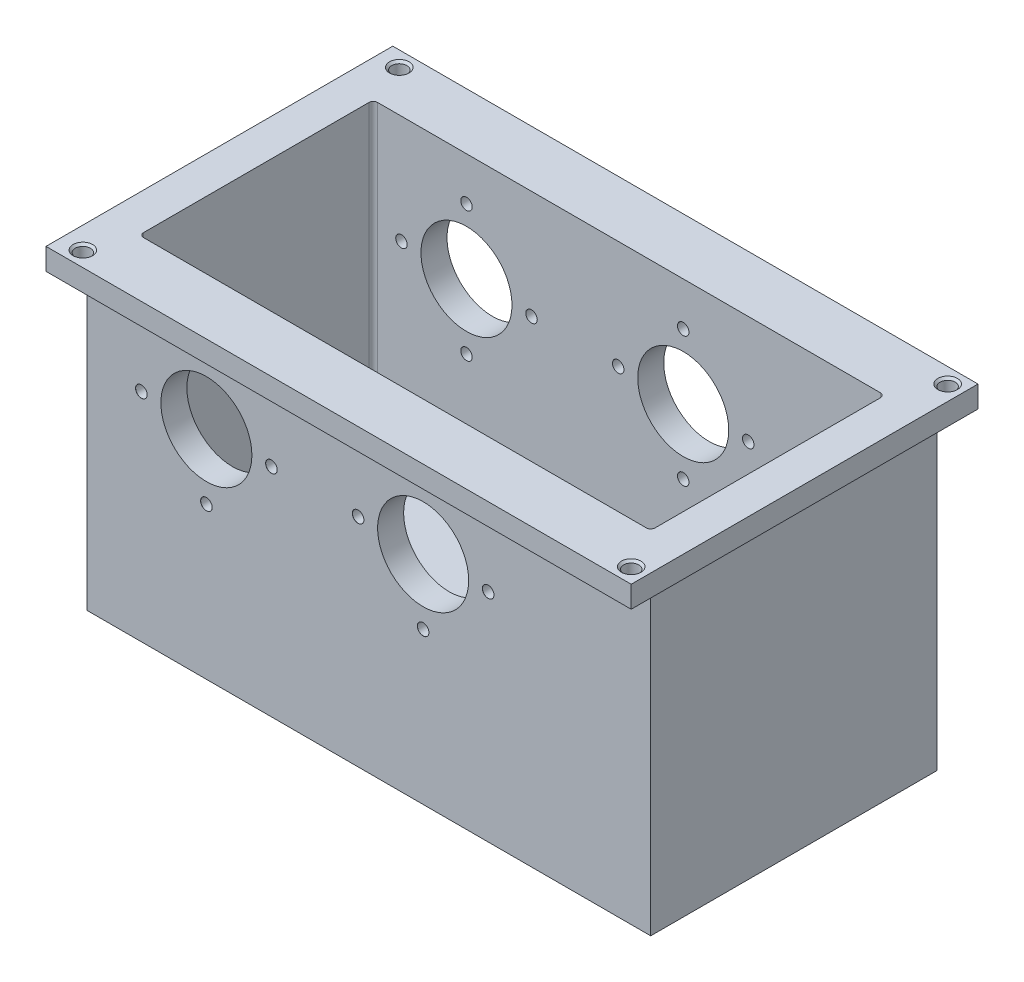
from build123d import *

# Parameters (mm, degrees)
SKETCH1_W                      = 260
SKETCH1_H                      = 132
BOSS_EXTRUDE1_DEPTH            = 150
SHELL1_T                       = -12
SKETCH2_W                      = 270
SKETCH2_H                      = 160
SKETCH2_W_2                    = 260
SKETCH2_H_2                    = 132
BOSS_EXTRUDE2_DEPTH            = 10
SKETCH3_R                      = 3.5
CUT_EXTRUDE1_DEPTH             = 10
CUT_EXTRUDE2_REACH             = 251.08
SKETCH4_R                      = 21
CHAMFER1_SIZE                  = 1
FILLET1_R                      = 2
M5_CLEARANCE_HOLE1_D           = 5.3
M5_CLEARANCE_HOLE1_CSINK_D     = 5.35
M5_CLEARANCE_HOLE1_CSINK_ANGLE = 90


with BuildPart() as part:
    # Sketch1 → Boss-Extrude1 (new body)
    with BuildSketch(Plane(origin=(0, 0, 0), x_dir=(1, 0, 0), z_dir=(0, 1, 0))):
        Rectangle(SKETCH1_W, SKETCH1_H)
    extrude(amount=BOSS_EXTRUDE1_DEPTH)

    # Shell1
    shell1_openings = [part.faces().sort_by_distance(p)[0] for p in [
        (0, 150, 0),
    ]]
    offset(amount=SHELL1_T, openings=shell1_openings, kind=Kind.INTERSECTION)

    # Sketch2 → Boss-Extrude2 (add)
    with BuildSketch(Plane(origin=(0, 150, 0), x_dir=(1, 0, 0), z_dir=(0, 1, 0))):
        Rectangle(SKETCH2_W, SKETCH2_H)
        Rectangle(SKETCH2_W_2, SKETCH2_H_2, mode=Mode.SUBTRACT)
    extrude(amount=-BOSS_EXTRUDE2_DEPTH)

    # Sketch3 → Cut-Extrude1 (cut)
    with BuildSketch(Plane(origin=(0, 150, 0), x_dir=(1, 0, 0), z_dir=(0, 1, 0))):
        with Locations(Location((-125, 73, 0), (0, 0, 270))):
            Circle(SKETCH3_R)
        with Locations(Location((128, 73, 0), (0, 0, 270))):
            Circle(SKETCH3_R)
        with Locations(Location((128, -73, 0), (0, 0, 270))):
            Circle(SKETCH3_R)
        with Locations(Location((-125, -73, 0), (0, 0, 270))):
            Circle(SKETCH3_R)
    extrude(amount=-CUT_EXTRUDE1_DEPTH, mode=Mode.SUBTRACT)

    # Cut-Extrude2: up to this face of the body (flat: up to its plane)
    cut_extrude2_end = Plane(part.part.faces().sort_by_distance((0, 70, -66))[0])
    # Sketch4 → Cut-Extrude2 (cut, up to the picked face)
    with BuildSketch(Plane.XY.offset(66), mode=Mode.PRIVATE) as cut_extrude2_sk1:
        with Locations((-75, 100)):
            Circle(SKETCH4_R)
    cut_extrude2_tool1 = split(extrude(cut_extrude2_sk1.sketch, amount=-CUT_EXTRUDE2_REACH, mode=Mode.PRIVATE), bisect_by=cut_extrude2_end, keep=Keep.BOTH, mode=Mode.PRIVATE)
    # Sketch4 → Cut-Extrude2 (cut, up to the picked face)
    with BuildSketch(Plane.XY.offset(66), mode=Mode.PRIVATE) as cut_extrude2_sk2:
        with Locations((25, 100)):
            Circle(SKETCH4_R)
    cut_extrude2_tool2 = split(extrude(cut_extrude2_sk2.sketch, amount=-CUT_EXTRUDE2_REACH, mode=Mode.PRIVATE), bisect_by=cut_extrude2_end, keep=Keep.BOTH, mode=Mode.PRIVATE)
    add(cut_extrude2_tool1.solids().sort_by(Axis((-75, 100, 66), (0, 0, -1)))[0], mode=Mode.SUBTRACT)
    add(cut_extrude2_tool2.solids().sort_by(Axis((25, 100, 66), (0, 0, -1)))[0], mode=Mode.SUBTRACT)

    # Chamfer1
    chamfer1_edges = [part.edges().sort_by_distance(p)[0] for p in [
        (-125, 150, 69.5),
        (128, 150, 69.5),
        (128, 150, -76.5),
        (-125, 150, -76.5),
    ]]
    chamfer(chamfer1_edges, length=CHAMFER1_SIZE)

    # Fillet1
    fillet1_edges = [part.edges().sort_by_distance(p)[0] for p in [
        (-118, 12, 0),
        (-118, 81, -54),
        (0, 12, 54),
        (-118, 81, 54),
        (118, 12, 0),
        (118, 81, 54),
        (0, 12, -54),
        (118, 81, -54),
    ]]
    fillet(fillet1_edges, radius=FILLET1_R)

    # M5 Clearance Hole1 (through all)
    with Locations(Plane.XY.offset(66)):
        with Locations((55, 100), (-75, 130), (-105, 100), (-75, 70), (-45, 100), (25, 130), (-5, 100), (25, 70)):
            CounterSinkHole(M5_CLEARANCE_HOLE1_D / 2, M5_CLEARANCE_HOLE1_CSINK_D / 2, counter_sink_angle=M5_CLEARANCE_HOLE1_CSINK_ANGLE)


solid = part.part
